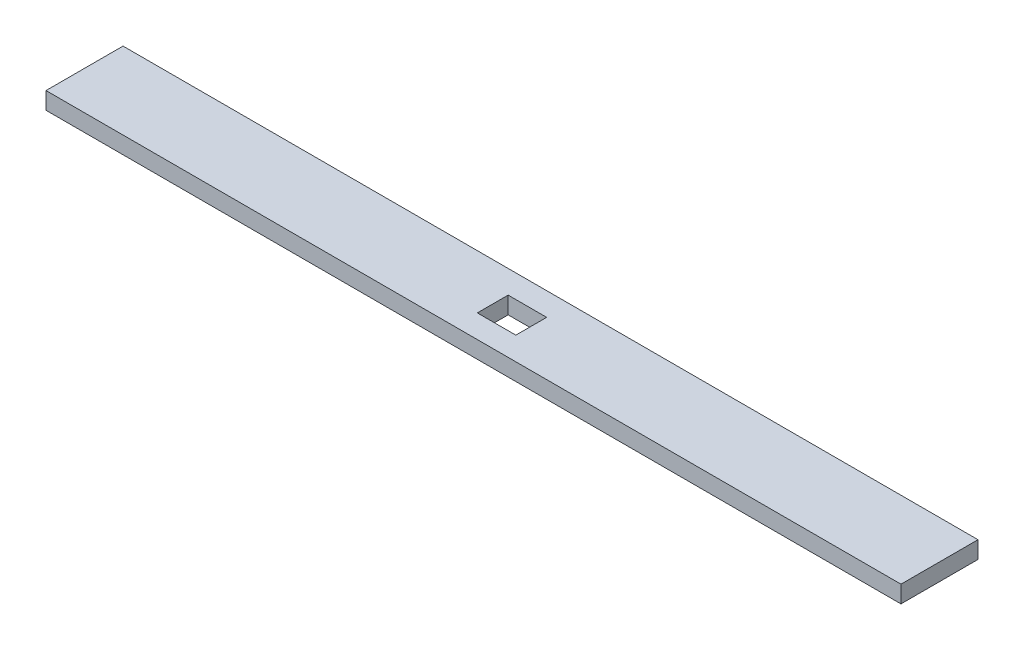
from build123d import *

# Parameters (mm, degrees)
SKETCH1_W           = 45
SKETCH1_H           = 10
BOSS_EXTRUDE1_DEPTH = 499.5
SKETCH2_W           = 22.5
SKETCH2_H           = 18
CUT_EXTRUDE1_DEPTH  = 502.622617114


with BuildPart() as part:
    # Sketch1 → Boss-Extrude1 (new body)
    with BuildSketch(Plane(origin=(0, 0, 0), x_dir=(0, 0, -1), z_dir=(1, 0, 0))):
        with Locations((22.5, 5)):
            Rectangle(SKETCH1_W, SKETCH1_H)
    extrude(amount=BOSS_EXTRUDE1_DEPTH)

    # Sketch2 → Cut-Extrude1 (cut, through all)
    with BuildSketch(Plane(origin=(0, 10, 0), x_dir=(1, 0, 0), z_dir=(0, 1, 0))):
        with Locations((249.75, 22.5)):
            Rectangle(SKETCH2_W, SKETCH2_H)
    extrude(amount=-CUT_EXTRUDE1_DEPTH, mode=Mode.SUBTRACT)


solid = part.part
